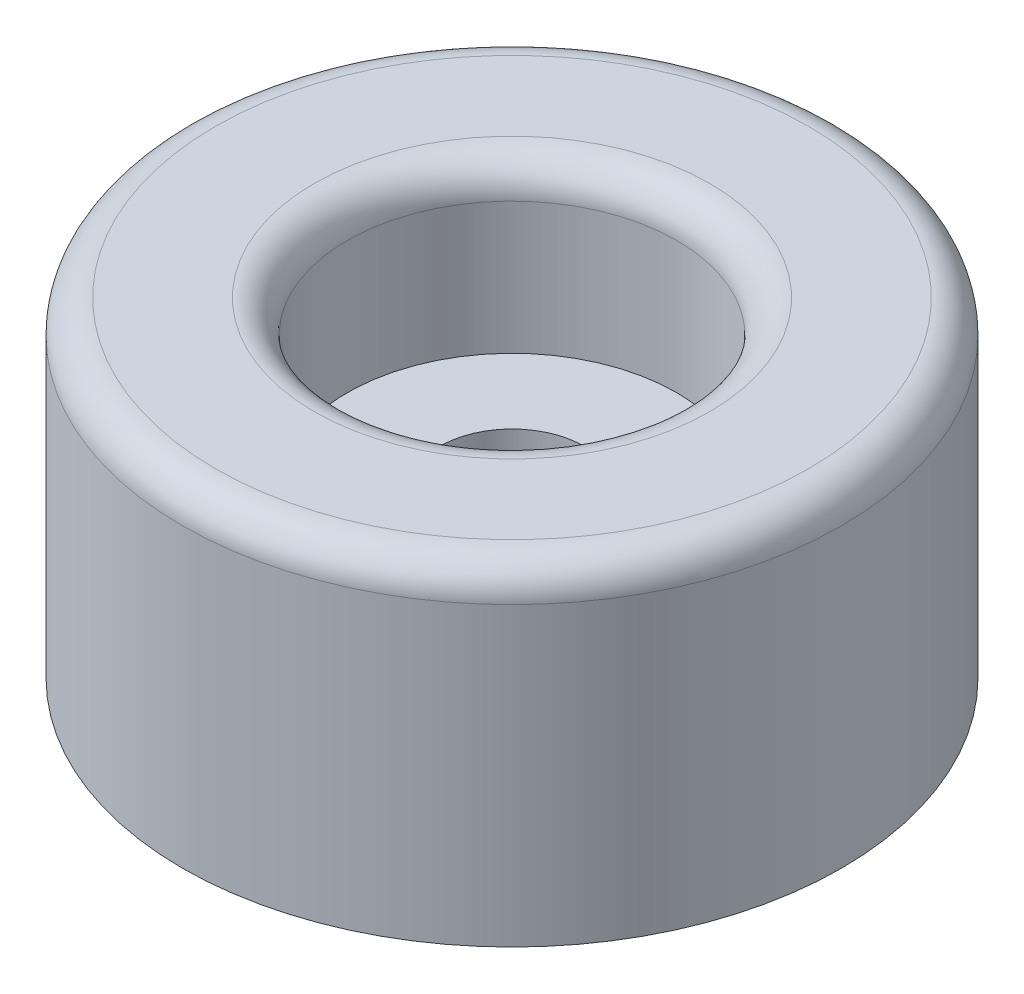
from build123d import *

# Parameters (mm, degrees)
SKETCH1_R           = 12.7
BOSS_EXTRUDE1_DEPTH = 12.7
SKETCH2_R           = 6.35
CUT_EXTRUDE1_DEPTH  = 6.35
SKETCH3_R           = 2.778125
CUT_EXTRUDE2_DEPTH  = 20.05
FILLET1_R           = 1.27


with BuildPart() as part:
    # Sketch1 → Boss-Extrude1 (new body)
    with BuildSketch(Plane(origin=(0, 0, 0), x_dir=(1, 0, 0), z_dir=(0, 1, 0))):
        with Locations(Location((0, 0, 0), (0, 0, 270))):
            Circle(SKETCH1_R)
    extrude(amount=BOSS_EXTRUDE1_DEPTH)

    # Sketch2 → Cut-Extrude1 (cut)
    with BuildSketch(Plane(origin=(0, 12.7, 0), x_dir=(1, 0, 0), z_dir=(0, 1, 0))):
        with Locations(Location((0, 0, 0), (0, 0, 270))):
            Circle(SKETCH2_R)
    extrude(amount=-CUT_EXTRUDE1_DEPTH, mode=Mode.SUBTRACT)

    # Sketch3 → Cut-Extrude2 (cut, through all)
    with BuildSketch(Plane(origin=(0, 6.35, 0), x_dir=(1, 0, 0), z_dir=(0, 1, 0))):
        with Locations(Location((0, 0, 0), (0, 0, 270))):
            Circle(SKETCH3_R)
    extrude(amount=-CUT_EXTRUDE2_DEPTH, mode=Mode.SUBTRACT)

    # Fillet1
    fillet1_edges = [part.edges().sort_by_distance(p)[0] for p in [
        (0, 12.7, -12.7),
        (0, 12.7, -6.35),
    ]]
    fillet(fillet1_edges, radius=FILLET1_R)


solid = part.part
